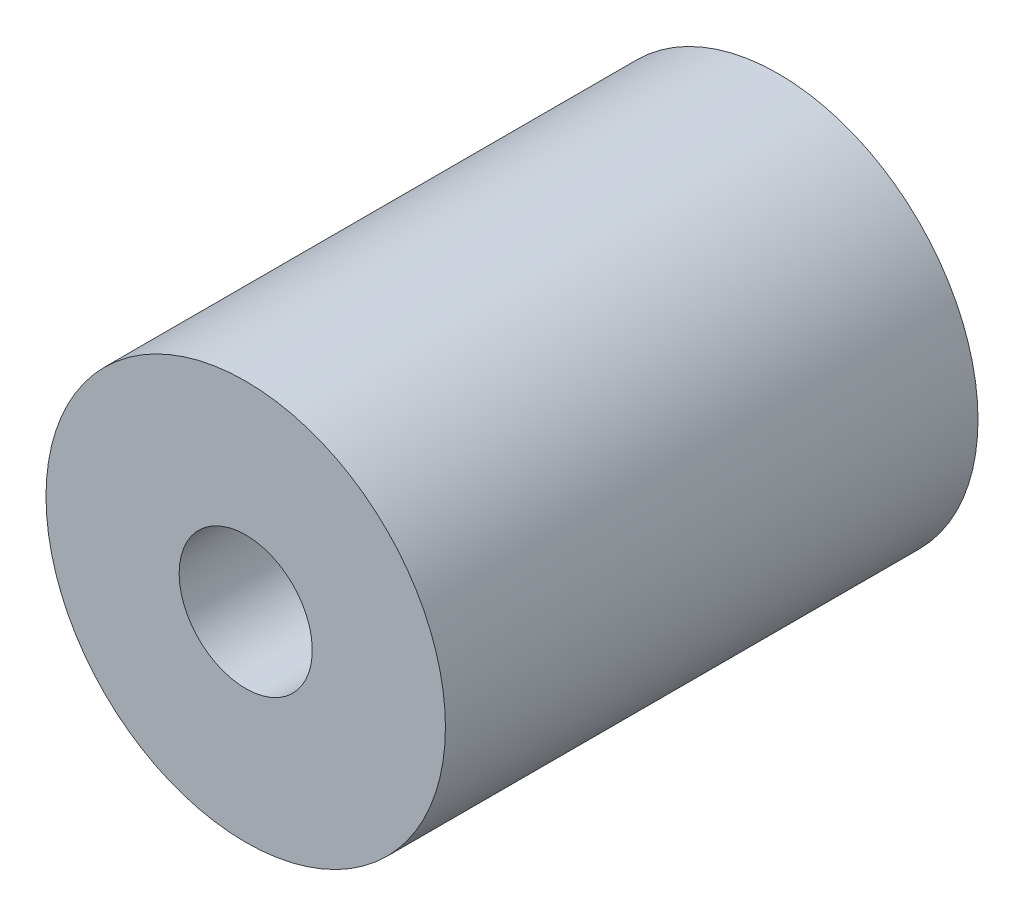
from build123d import *

# Parameters (mm, degrees)
CUT_EXTRUDE1_REACH      = 20.513
CUT_EXTRUDE1_END_RADIUS = 9.525
SKETCH2_R               = 1.9685


with BuildPart() as part:
    # Sketch1 → Revolve1 (revolve)
    with BuildSketch(Plane(origin=(0, 0, 0), x_dir=(0, 0, -1), z_dir=(1, 0, 0))):
        Polygon((0, 3.175), (0, 6.35), (12.7, 6.35), (12.7, 9.525), (-12.7, 9.525), (-12.7, 3.175), align=None)
    revolve(axis=Axis((0, 0, 0), (0, 0, 1)))

    # Cut-Extrude1: up to this cylinder (the profile starts inside it)
    cut_extrude1_end = Plane(origin=(0, 0, 0), z_dir=(0, 0, -1)) * Cylinder(CUT_EXTRUDE1_END_RADIUS, 73.776, mode=Mode.PRIVATE)
    # Sketch2 → Cut-Extrude1 (cut, up to the surface)
    with BuildSketch(Plane(origin=(0, 0, 0), x_dir=(1, 0, 0), z_dir=(0, 1, 0)), mode=Mode.PRIVATE) as cut_extrude1_sk1:
        with Locations((0, -6.35)):
            Circle(SKETCH2_R)
    cut_extrude1_tool1 = extrude(cut_extrude1_sk1.sketch, amount=-CUT_EXTRUDE1_REACH, mode=Mode.PRIVATE) & cut_extrude1_end
    add(cut_extrude1_tool1.solids().sort_by_distance((0, 0, 6.35))[0], mode=Mode.SUBTRACT)
    # Sketch2 → Cut-Extrude1 (cut, up to the surface)
    with BuildSketch(Plane(origin=(0, 0, 0), x_dir=(1, 0, 0), z_dir=(0, 1, 0)), mode=Mode.PRIVATE) as cut_extrude1_sk2:
        with Locations((0, 6.35)):
            Circle(SKETCH2_R)
    cut_extrude1_tool2 = extrude(cut_extrude1_sk2.sketch, amount=-CUT_EXTRUDE1_REACH, mode=Mode.PRIVATE) & cut_extrude1_end
    add(cut_extrude1_tool2.solids().sort_by_distance((0, 0, -6.35))[0], mode=Mode.SUBTRACT)


solid = part.part
